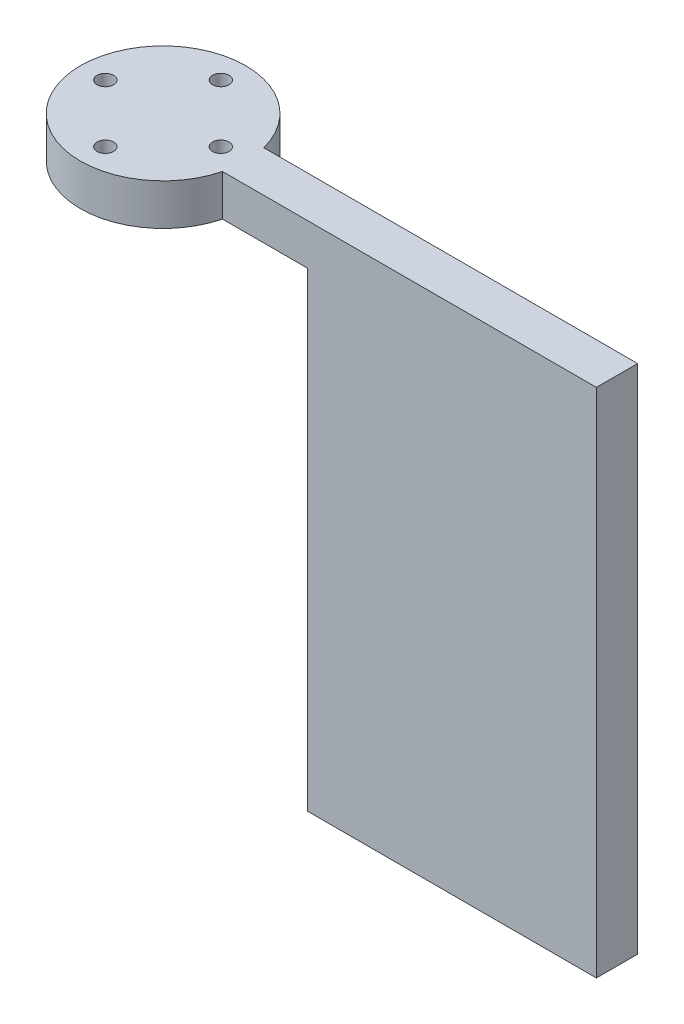
from build123d import *

# Parameters (mm, degrees)
SKETCH1_W           = 35
SKETCH1_H           = 62
SKETCH1_W_2         = 10
SKETCH1_H_2         = 5
BOSS_EXTRUDE1_DEPTH = 2.5
SKETCH2_R           = 10.02
SKETCH2_R_2         = 1
BOSS_EXTRUDE2_DEPTH = 5
BOSS_EXTRUDE3_DEPTH = 5


with BuildPart() as part:
    # Sketch1 → Boss-Extrude1 (new, symmetric)
    with BuildSketch(Plane.XY):
        with Locations((17.5, 31)):
            Rectangle(SKETCH1_W, SKETCH1_H)
        with Locations((-5, 59.5)):
            Rectangle(SKETCH1_W_2, SKETCH1_H_2)
    extrude(amount=BOSS_EXTRUDE1_DEPTH, both=True)



with BuildPart() as body_2:
    # Sketch2 → Boss-Extrude2 (new body)
    # profile 1 of 2: a face of its own
    with BuildSketch(Plane(origin=(0, 62, 0), x_dir=(1, 0, 0), z_dir=(0, 1, 0))):
        with Locations((-20.02, 0)):
            Circle(SKETCH2_R)
        with Locations(Location((-13.02, 0, 0), (0, 0, 270))):
            Circle(SKETCH2_R_2, mode=Mode.SUBTRACT)
        with Locations(Location((-20.02, -7, 0), (0, 0, 270))):
            Circle(SKETCH2_R_2, mode=Mode.SUBTRACT)
        with Locations(Location((-27.02, 0, 0), (0, 0, 270))):
            Circle(SKETCH2_R_2, mode=Mode.SUBTRACT)
        with Locations(Location((-20.02, 7, 0), (0, 0, 270))):
            Circle(SKETCH2_R_2, mode=Mode.SUBTRACT)
    # profile 2 of 2: a face of its own
    with BuildSketch(Plane(origin=(0, 62, 0), x_dir=(1, 0, 0), z_dir=(0, 1, 0))):
        with BuildLine():
            Line((-10, 0), (-10, 2.5))
            Line((-10, 2.5), (-10.316887097, 2.5))
            ThreePointArc((-10.316887097, 2.5), (-10.079537453, 1.260001729), (-10, 0))
        make_face()
    extrude(amount=-BOSS_EXTRUDE2_DEPTH)


with BuildPart() as part_1:
    add(part.part)

    add(body_2.part)  # Boss-Extrude3 merges body 2
    # Sketch3 → Boss-Extrude3 (add)
    with BuildSketch(Plane(origin=(0, 62, 0), x_dir=(1, 0, 0), z_dir=(0, 1, 0))):
        with BuildLine():
            Line((-10, 0), (-10, -2.5))
            Line((-10, -2.5), (-10.316887097, -2.5))
            ThreePointArc((-10.316887097, -2.5), (-10.079537453, -1.260001729), (-10, 0))
        make_face()
    extrude(amount=-BOSS_EXTRUDE3_DEPTH)


solid = part_1.part
